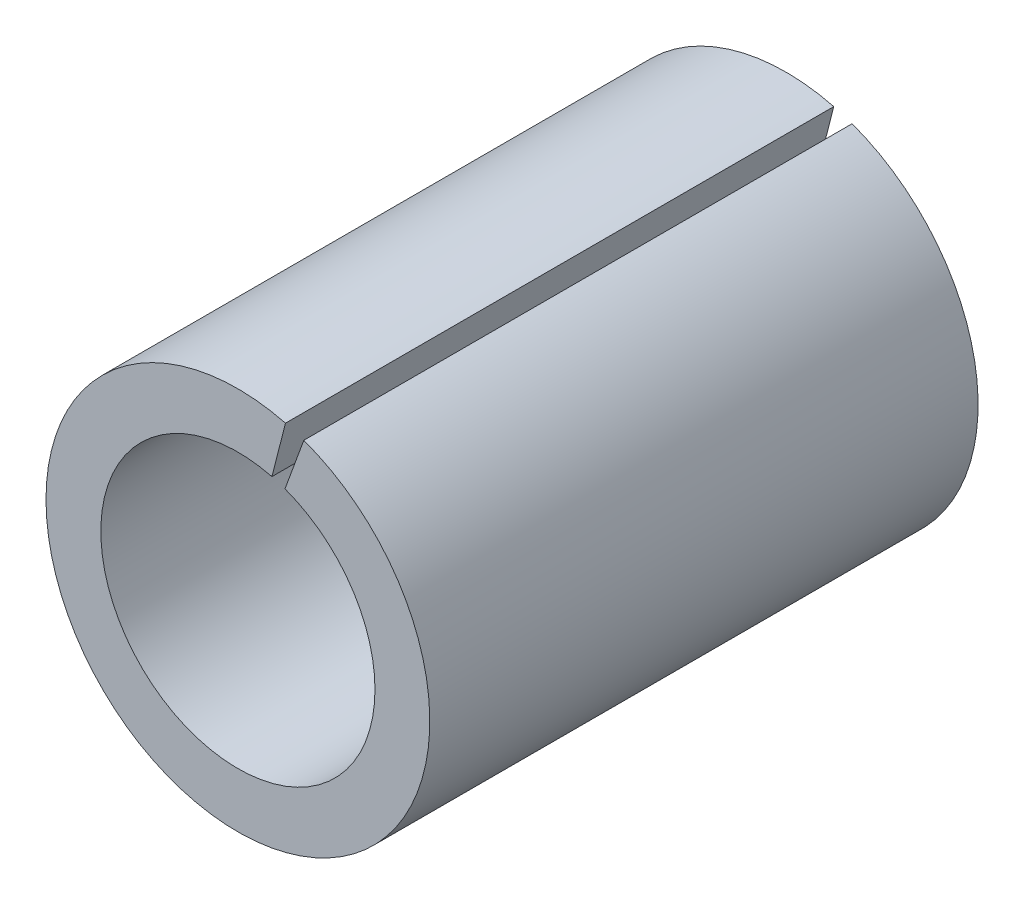
from build123d import *

# Parameters (mm, degrees)
SKETCH_1_R          = 3.5
SKETCH_1_R_2        = 2.5
EXTRUDE_1_DEPTH     = 10
CUT_EXTRUDE_1_DEPTH = 100


with BuildPart() as part:
    # 草图1 → 凸台-拉伸1 (new body)
    with BuildSketch(Plane.XY):
        Circle(SKETCH_1_R)
        Circle(SKETCH_1_R_2, mode=Mode.SUBTRACT)
    extrude(amount=EXTRUDE_1_DEPTH)

    # 草图2 → 切除-拉伸1 (cut)
    with BuildSketch(Plane.XY.offset(10)):
        Polygon((0, 0), (1.195643568, 4.670187004), (1.708170359, 4.670187004), align=None)
    extrude(amount=-CUT_EXTRUDE_1_DEPTH, mode=Mode.SUBTRACT)


solid = part.part
